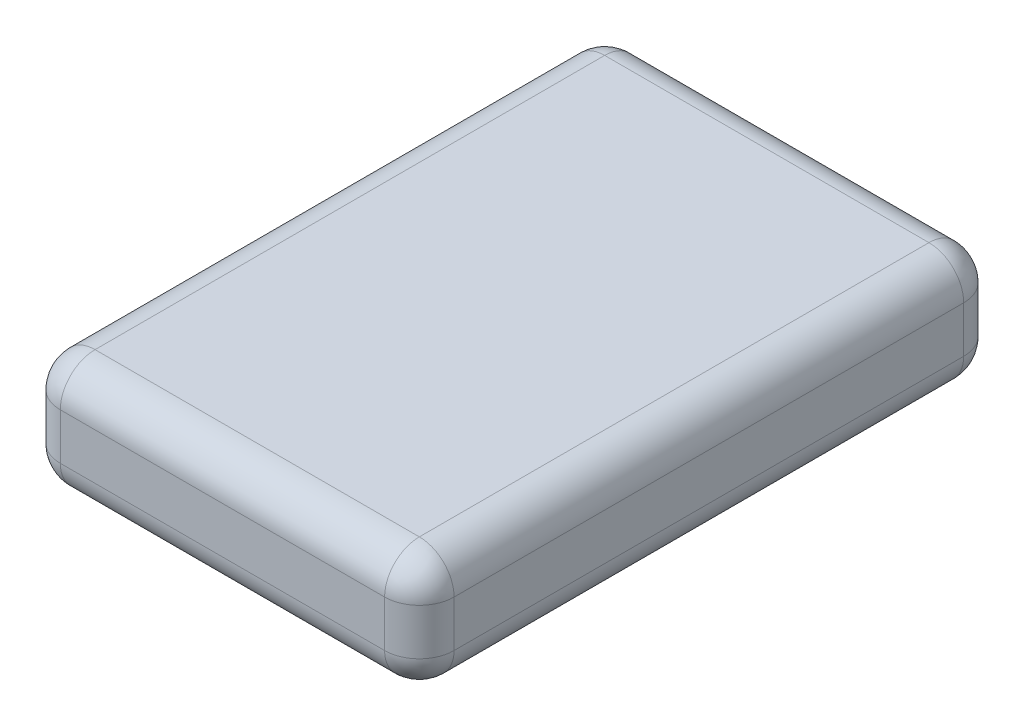
from build123d import *

# Parameters (mm, degrees)
SKETCH1_W           = 34
SKETCH1_H           = 50
BOSS_EXTRUDE1_DEPTH = 10
FILLET1_R           = 3
FILLET2_R           = 3


with BuildPart() as part:
    # Sketch1 → Boss-Extrude1 (new body)
    with BuildSketch(Plane(origin=(0, 0, 0), x_dir=(1, 0, 0), z_dir=(0, 1, 0))):
        Rectangle(SKETCH1_W, SKETCH1_H)
    extrude(amount=BOSS_EXTRUDE1_DEPTH)

    # Fillet1
    fillet1_edges = [part.edges().sort_by_distance(p)[0] for p in [
        (-17, 10, 0),
        (17, 10, 0),
        (-17, 0, 0),
        (17, 0, 0),
    ]]
    fillet(fillet1_edges, radius=FILLET1_R)

    # Fillet2
    fillet2_edges = [part.edges().sort_by_distance(p)[0] for p in [
        (-17, 5, 25),
        (-17, 5, -25),
        (0, 0, 25),
        (17, 5, 25),
        (0, 10, 25),
        (16.121320344, 9.121320344, 25),
        (16.121320344, 0.878679656, 25),
        (-16.121320344, 9.121320344, 25),
        (-16.121320344, 0.878679656, 25),
        (0, 0, -25),
        (0, 10, -25),
        (17, 5, -25),
        (16.121320344, 9.121320344, -25),
        (16.121320344, 0.878679656, -25),
        (-16.121320344, 9.121320344, -25),
        (-16.121320344, 0.878679656, -25),
    ]]
    fillet(fillet2_edges, radius=FILLET2_R)


solid = part.part
